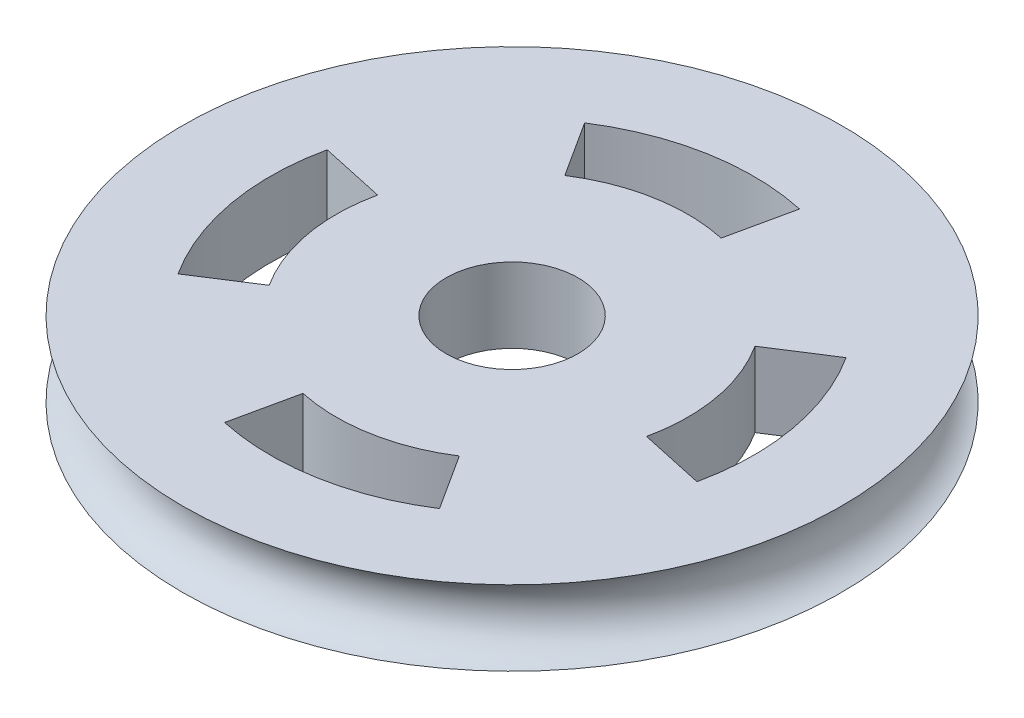
from build123d import *

# Parameters (mm, degrees)
TAGLIO_ESTRUSIONE1_DEPTH    = 18.035037423
RIPETIZIONECIRCOLARE1_COUNT = 4


with BuildPart() as part:
    # Schizzo1 → Rivoluzione1 (revolve)
    with BuildSketch(Plane.XY, mode=Mode.PRIVATE) as rivoluzione1_sk:
        with BuildLine():
            Line((0.2, 0.851836252), (6.2, 0.851836252))
            Line((6.2, 0.851836252), (6.2, -0.851836252))
            Line((6.2, -0.851836252), (0.2, -0.851836252))
            ThreePointArc((0.2, -0.851836252), (0.875, 0), (0.2, 0.851836252))
        make_face()
    revolve(rivoluzione1_sk.sketch.rotate(Axis((7.7, 1.619035734, 0), (0, -1, 0)), 270), axis=Axis((7.7, 1.619035734, 0), (0, -1, 0)))

    # Schizzo2 → Taglio-Estrusione1 (cut, through all)
    with BuildSketch(Plane.XZ.offset(0.851836252)):
        with BuildLine():
            Line((4.335758437, 2.163764938), (3.074167851, 2.97517679))
            ThreePointArc((3.074167851, 2.97517679), (2.287737491, 0.978475617), (2.325275036, -1.167189598))
            Line((2.325275036, -1.167189598), (3.791109117, -0.848865162))
            ThreePointArc((3.791109117, -0.848865162), (3.763809084, 0.711618631), (4.335758437, 2.163764938))
        make_face()
    taglio_estrusione1 = extrude(amount=-TAGLIO_ESTRUSIONE1_DEPTH, mode=Mode.SUBTRACT)

    # RipetizioneCircolare1: Taglio-Estrusione1 ×4 about axis
    ripetizionecircolare1_axis = Axis((7.7, -0.851836252, 0), (0, 1, 0))
    for i in range(1, RIPETIZIONECIRCOLARE1_COUNT):
        add(taglio_estrusione1.rotate(ripetizionecircolare1_axis, i * 360 / RIPETIZIONECIRCOLARE1_COUNT), mode=Mode.SUBTRACT)


solid = part.part
